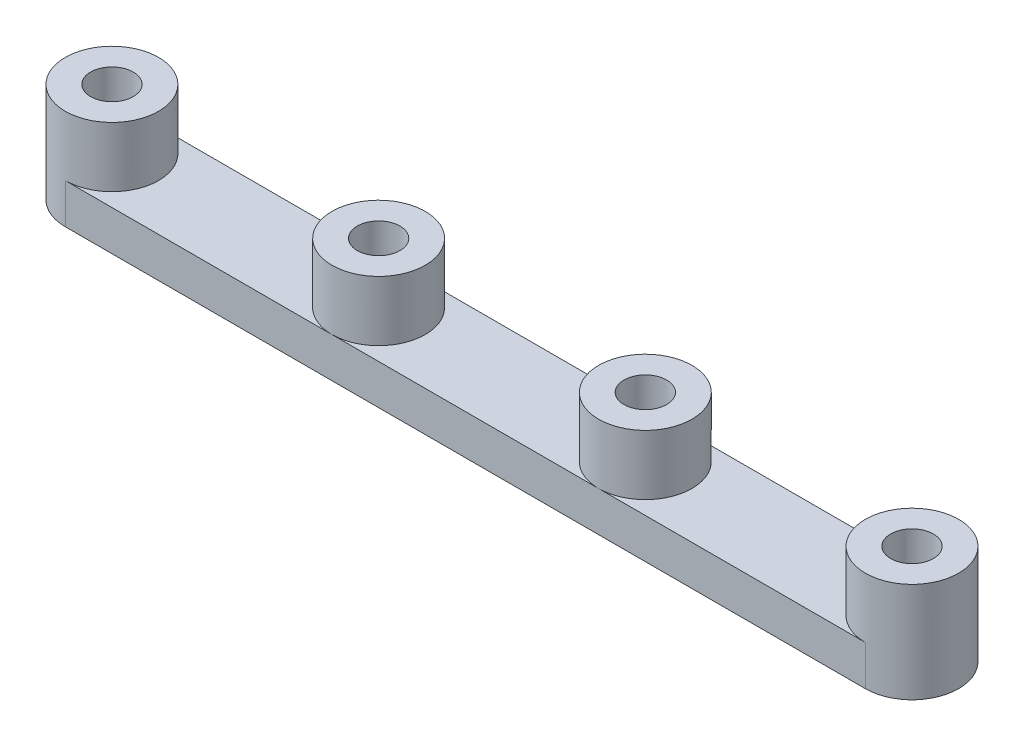
from build123d import *

# Parameters (mm, degrees)
SKETCH1_R           = 1.6
BOSS_EXTRUDE1_DEPTH = 3
SKETCH2_R           = 3.5
SKETCH2_R_2         = 1.6
BOSS_EXTRUDE2_DEPTH = 4.5


with BuildPart() as part:
    # Sketch1 → Boss-Extrude1 (new body)
    with BuildSketch(Plane(origin=(0, 0, 0), x_dir=(1, 0, 0), z_dir=(0, 1, 0))):
        with BuildLine():
            Line((30, -3.5), (-30, -3.5))
            ThreePointArc((-30, -3.5), (-33.5, 0), (-30, 3.5))
            Line((-30, 3.5), (30, 3.5))
            ThreePointArc((30, 3.5), (33.5, 0), (30, -3.5))
        make_face()
        with Locations(Location((-30, 0, 0), (0, 0, 270))):
            Circle(SKETCH1_R, mode=Mode.SUBTRACT)
        with Locations(Location((-10, 0, 0), (0, 0, 270))):
            Circle(SKETCH1_R, mode=Mode.SUBTRACT)
        with Locations(Location((10, 0, 0), (0, 0, 270))):
            Circle(SKETCH1_R, mode=Mode.SUBTRACT)
        with Locations(Location((30, 0, 0), (0, 0, 270))):
            Circle(SKETCH1_R, mode=Mode.SUBTRACT)
    extrude(amount=BOSS_EXTRUDE1_DEPTH)

    # Sketch2 → Boss-Extrude2 (add)
    # profile 1 of 4: a face of its own
    with BuildSketch(Plane(origin=(0, 3, 0), x_dir=(1, 0, 0), z_dir=(0, 1, 0))):
        with Locations(Location((-30, 0, 0), (0, 0, 270))):
            Circle(SKETCH2_R)
        with Locations(Location((-30, 0, 0), (0, 0, 270))):
            Circle(SKETCH2_R_2, mode=Mode.SUBTRACT)
    # profile 2 of 4: a face of its own
    with BuildSketch(Plane(origin=(0, 3, 0), x_dir=(1, 0, 0), z_dir=(0, 1, 0))):
        with Locations(Location((-10, 0, 0), (0, 0, 270))):
            Circle(SKETCH2_R)
        with Locations(Location((-10, 0, 0), (0, 0, 270))):
            Circle(SKETCH2_R_2, mode=Mode.SUBTRACT)
    # profile 3 of 4: a face of its own
    with BuildSketch(Plane(origin=(0, 3, 0), x_dir=(1, 0, 0), z_dir=(0, 1, 0))):
        with Locations(Location((10, 0, 0), (0, 0, 270))):
            Circle(SKETCH2_R)
        with Locations(Location((10, 0, 0), (0, 0, 270))):
            Circle(SKETCH2_R_2, mode=Mode.SUBTRACT)
    # profile 4 of 4: a face of its own
    with BuildSketch(Plane(origin=(0, 3, 0), x_dir=(1, 0, 0), z_dir=(0, 1, 0))):
        with Locations(Location((30, 0, 0), (0, 0, 270))):
            Circle(SKETCH2_R)
        with Locations(Location((30, 0, 0), (0, 0, 270))):
            Circle(SKETCH2_R_2, mode=Mode.SUBTRACT)
    extrude(amount=BOSS_EXTRUDE2_DEPTH)


solid = part.part
